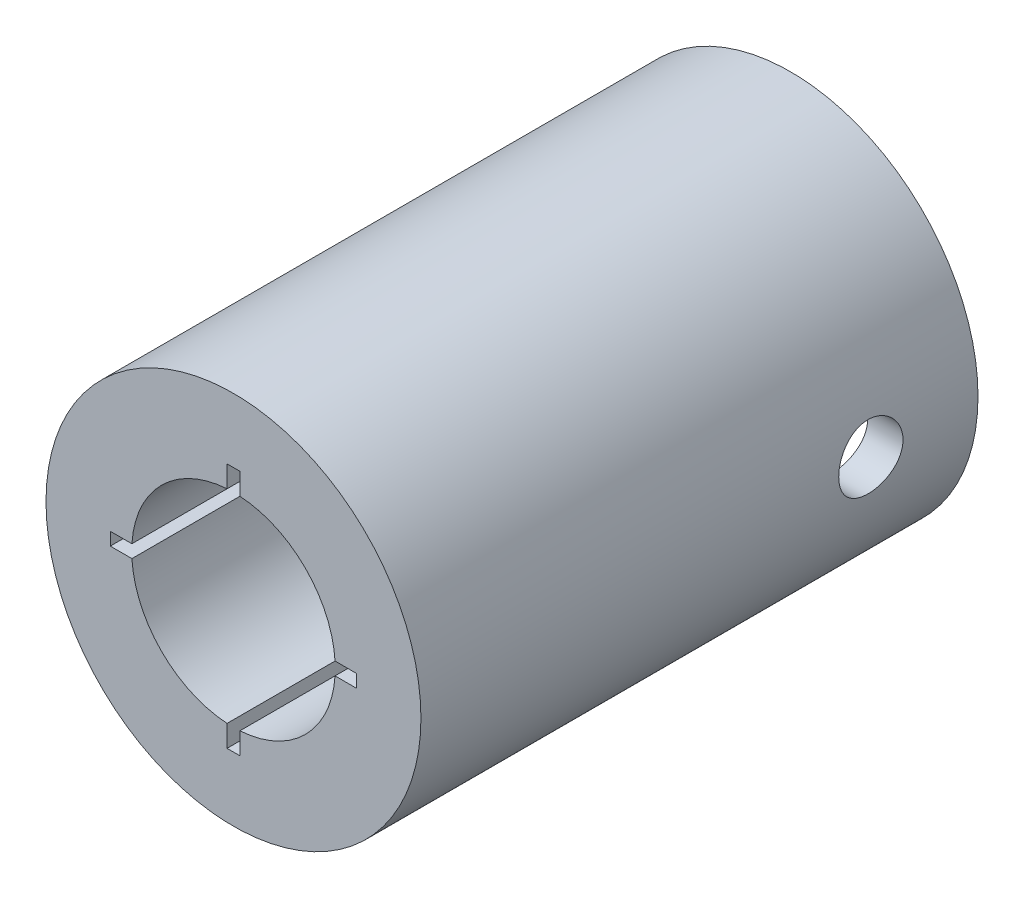
from build123d import *

# Parameters (mm, degrees)
SKETCH_1_R               = 8.75
SKETCH_1_R_2             = 7.1
EXTRUDE_1_DEPTH          = 10
CUT_EXTRUDE_1_DEPTH      = 20
CUT_EXTRUDE_1_DEPTH_BACK = 10
SKETCH_2_R               = 1.5
SKETCH_3_R               = 8.75
SKETCH_3_R_2             = 4.75
EXTRUDE_2_DEPTH          = 16
CUT_EXTRUDE_START        = -8
CUT_EXTRUDE_2_DEPTH      = 8


with BuildPart() as part:
    # 草图1 → 凸台-拉伸1 (new body)
    with BuildSketch(Plane.XY):
        Circle(SKETCH_1_R)
        Circle(SKETCH_1_R_2, mode=Mode.SUBTRACT)
    extrude(amount=EXTRUDE_1_DEPTH)

    # 草图2 → 切除-拉伸1 (cut, two sides: drawn at the far end of the back side and taken through both)
    with BuildSketch(Plane(origin=(0, 0, 0), x_dir=(0, 0, -1), z_dir=(1, 0, 0)).offset(-CUT_EXTRUDE_1_DEPTH_BACK)):
        with Locations((-5, 0)):
            Circle(SKETCH_2_R)
    extrude(amount=CUT_EXTRUDE_1_DEPTH + CUT_EXTRUDE_1_DEPTH_BACK, mode=Mode.SUBTRACT)

    # 草图3 → 凸台-拉伸2 (add)
    with BuildSketch(Plane.XY.offset(10)):
        Circle(SKETCH_3_R)
        Circle(SKETCH_3_R_2, mode=Mode.SUBTRACT)
    extrude(amount=EXTRUDE_2_DEPTH)

    # 草图4 → 切除-拉伸2 (cut)
    with BuildSketch(Plane.XY.offset(26).offset(CUT_EXTRUDE_START)):
        with BuildLine():
            Line((-0.3, -4.740516849), (-0.3, -5.75))
            Line((-0.3, -5.75), (0.3, -5.75))
            Line((0.3, -5.75), (0.3, -4.740516849))
            ThreePointArc((0.3, -4.740516849), (0, -4.75), (-0.3, -4.740516849))
        make_face()
        with BuildLine():
            Line((-5.75, -0.3), (-4.740516849, -0.3))
            ThreePointArc((-4.740516849, -0.3), (-4.75, 0), (-4.740516849, 0.3))
            Line((-4.740516849, 0.3), (-5.75, 0.3))
            Line((-5.75, 0.3), (-5.75, -0.3))
        make_face()
        with BuildLine():
            Line((-0.3, 5.75), (-0.3, 4.740516849))
            ThreePointArc((-0.3, 4.740516849), (0, 4.75), (0.3, 4.740516849))
            Line((0.3, 4.740516849), (0.3, 5.75))
            Line((0.3, 5.75), (-0.3, 5.75))
        make_face()
        with BuildLine():
            Line((5.75, 0.3), (4.740516849, 0.3))
            ThreePointArc((4.740516849, 0.3), (4.75, 0), (4.740516849, -0.3))
            Line((4.740516849, -0.3), (5.75, -0.3))
            Line((5.75, -0.3), (5.75, 0.3))
        make_face()
    extrude(amount=CUT_EXTRUDE_2_DEPTH, mode=Mode.SUBTRACT)


solid = part.part
